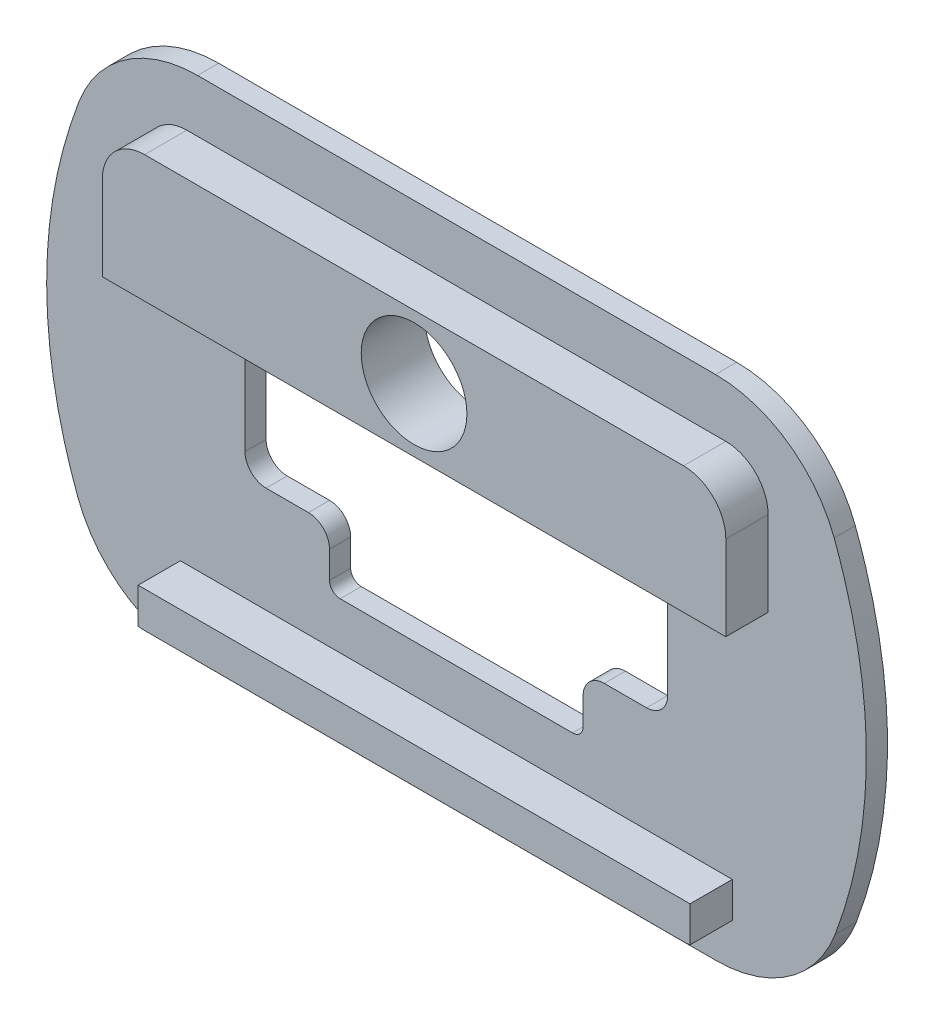
from build123d import *

# Parameters (mm, degrees)
BOSS_EXTRUDE1_DEPTH     = 1
BOSS_EXTRUDE2_DEPTH     = 3
CUT_EXTRUDE3_DEPTH      = 3
SKETCH7_W               = 29.714207492
SKETCH7_H               = 11.789960261
CUT_EXTRUDE4_DEPTH      = 2
CUT_EXTRUDE5_DEPTH      = 33.440982602
CUT_EXTRUDE5_DEPTH_BACK = 33.440982602
SKETCH6_R               = 2.5


with BuildPart() as part:
    # Sketch4 → Boss-Extrude1 (new body)
    with BuildSketch(Plane.XY):
        with BuildLine():
            Line((-11.46999612, 1.189613235), (13.12949411, 1.189613235))
            ThreePointArc((13.12949411, 1.189613235), (16.545477006, 2.256960718), (18.746112986, 5.079259617))
            add(Edge.make_bspline(
                [(18.746112986, 5.079259617), (19.737187318, 7.716962964), (20.720796973, 13.218046534), (19.706022352, 18.616089167), (18.698180615, 21.299335004)],
                knots=[0.167422492, 0.167422492, 0.167422492, 0.167422492, 0.502499344, 0.837905074, 0.837905074, 0.837905074, 0.837905074], degree=3))
            ThreePointArc((18.698180615, 21.299335004), (16.497584709, 24.122073606), (13.081324372, 25.189613235))
            Line((13.081324372, 25.189613235), (-11.421826382, 25.189613235))
            ThreePointArc((-11.421826382, 25.189613235), (-14.838086719, 24.122073606), (-17.038682625, 21.299335004))
            add(Edge.make_bspline(
                [(-17.086614996, 5.079259617), (-18.077689328, 7.716962964), (-19.061298983, 13.218046534), (-18.046524362, 18.616089167), (-17.038682625, 21.299335004)],
                knots=[0.167422492, 0.167422492, 0.167422492, 0.167422492, 0.502499344, 0.837905074, 0.837905074, 0.837905074, 0.837905074], degree=3))
            ThreePointArc((-17.086614996, 5.079259617), (-14.885979016, 2.256960718), (-11.46999612, 1.189613235))
        make_face()
    extrude(amount=BOSS_EXTRUDE1_DEPTH)

    # Sketch1 → Boss-Extrude2 (add)
    with BuildSketch(Plane.XY):
        with BuildLine():
            Line((-11.928396375, 3.192285122), (13.571603625, 3.192285122))
            ThreePointArc((13.571603625, 3.192285122), (13.725432705, 3.198209744), (13.878350405, 3.215948508))
            Line((13.878350405, 3.215948508), (13.878350405, 6.42715263))
            ThreePointArc((13.878350405, 6.42715263), (14.024797015, 6.780706021), (14.378350405, 6.92715263))
            Line((14.378350405, 6.92715263), (15.571603625, 6.92715263))
            Line((15.571603625, 6.92715263), (15.571603625, 20.692285122))
            ThreePointArc((15.571603625, 20.692285122), (14.985817187, 22.106498684), (13.571603625, 22.692285122))
            Line((13.571603625, 22.692285122), (-11.928396375, 22.692285122))
            ThreePointArc((-11.928396375, 22.692285122), (-13.342609938, 22.106498684), (-13.928396375, 20.692285122))
            Line((-13.928396375, 20.692285122), (-13.928396375, 6.92715263))
            Line((-13.928396375, 6.92715263), (-12.735143156, 6.92715263))
            ThreePointArc((-12.735143156, 6.92715263), (-12.381589765, 6.780706021), (-12.235143156, 6.42715263))
            Line((-12.235143156, 6.42715263), (-12.235143156, 3.215948508))
            ThreePointArc((-12.235143156, 3.215948508), (-12.082225455, 3.198209744), (-11.928396375, 3.192285122))
        make_face()
    extrude(amount=BOSS_EXTRUDE2_DEPTH)

    # Sketch2 → Cut-Extrude3 (cut)
    with BuildSketch(Plane.XY):
        with BuildLine():
            Line((-4.678396375, 7.121027254), (6.321603625, 7.121027254))
            ThreePointArc((6.321603625, 7.121027254), (6.675157015, 7.267473863), (6.821603625, 7.621027254))
            Line((6.821603625, 7.621027254), (6.821603625, 8.901007801))
            ThreePointArc((6.821603625, 8.901007801), (7.114496843, 9.608114582), (7.821603625, 9.901007801))
            Line((7.821603625, 9.901007801), (9.821603625, 9.901007801))
            ThreePointArc((9.821603625, 9.901007801), (10.528710406, 10.19390102), (10.821603625, 10.901007801))
            Line((10.821603625, 10.901007801), (10.821603625, 14.92428318))
            ThreePointArc((10.821603625, 14.92428318), (10.528710406, 15.631389961), (9.821603625, 15.92428318))
            Line((9.821603625, 15.92428318), (-8.178396375, 15.92428318))
            ThreePointArc((-8.178396375, 15.92428318), (-8.885503157, 15.631389961), (-9.178396375, 14.92428318))
            Line((-9.178396375, 14.92428318), (-9.178396375, 10.901007801))
            ThreePointArc((-9.178396375, 10.901007801), (-8.885503157, 10.19390102), (-8.178396375, 9.901007801))
            Line((-8.178396375, 9.901007801), (-6.178396375, 9.901007801))
            ThreePointArc((-6.178396375, 9.901007801), (-5.471289594, 9.608114582), (-5.178396375, 8.901007801))
            Line((-5.178396375, 8.901007801), (-5.178396375, 7.621027254))
            ThreePointArc((-5.178396375, 7.621027254), (-5.031949766, 7.267473863), (-4.678396375, 7.121027254))
        make_face()
    extrude(amount=CUT_EXTRUDE3_DEPTH, mode=Mode.SUBTRACT)

    # Sketch7 → Cut-Extrude4 (cut)
    with BuildSketch(Plane.XY.offset(3)):
        with Locations((0.928707371, 10.792421827)):
            Rectangle(SKETCH7_W, SKETCH7_H)
    extrude(amount=-CUT_EXTRUDE4_DEPTH, mode=Mode.SUBTRACT)

    # Sketch6 → Cut-Extrude5 (cut, two sides: drawn at the far end of the back side and taken through both)
    with BuildSketch(Plane.XY.offset(3).offset(-CUT_EXTRUDE5_DEPTH_BACK)):
        with Locations((0.821603625, 19.685063144)):
            Circle(SKETCH6_R)
    extrude(amount=CUT_EXTRUDE5_DEPTH + CUT_EXTRUDE5_DEPTH_BACK, mode=Mode.SUBTRACT)


solid = part.part
